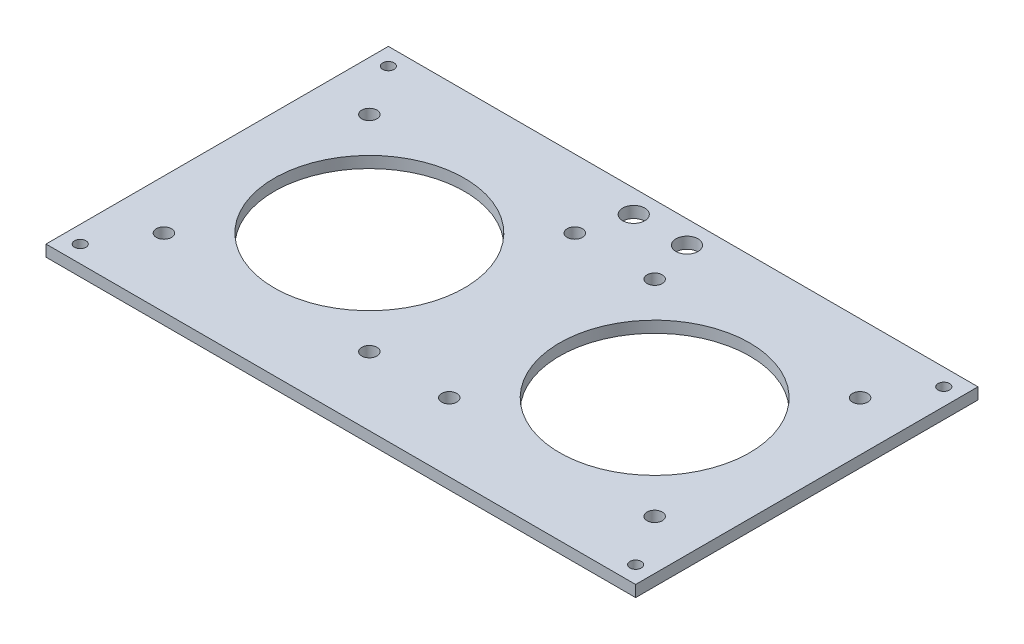
from build123d import *

# Parameters (mm, degrees)
ESQUISSE1_W        = 155
ESQUISSE1_H        = 90
ESQUISSE1_R        = 25
ESQUISSE1_R_2      = 2
ESQUISSE1_R_3      = 1.5
ESQUISSE1_R_4      = 2.9
BOSS_EXTRU_1_DEPTH = 3


with BuildPart() as part:
    # Esquisse1 → Boss.-Extru.1 (new body)
    with BuildSketch(Plane(origin=(0, 0, 0), x_dir=(1, 0, 0), z_dir=(0, 1, 0))):
        Rectangle(ESQUISSE1_W, ESQUISSE1_H)
        with Locations(Location((-37.5, 0, 0), (0, 0, 270))):
            Circle(ESQUISSE1_R, mode=Mode.SUBTRACT)
        with Locations(Location((-64.5, 27, 0), (0, 0, 270))):
            Circle(ESQUISSE1_R_2, mode=Mode.SUBTRACT)
        with Locations(Location((-10.5, 27, 0), (0, 0, 90))):
            Circle(ESQUISSE1_R_2, mode=Mode.SUBTRACT)
        with Locations(Location((-10.5, -27, 0), (0, 0, 270))):
            Circle(ESQUISSE1_R_2, mode=Mode.SUBTRACT)
        with Locations(Location((-64.5, -27, 0), (0, 0, 90))):
            Circle(ESQUISSE1_R_2, mode=Mode.SUBTRACT)
        with Locations(Location((10.5, -27, 0), (0, 0, 90))):
            Circle(ESQUISSE1_R_2, mode=Mode.SUBTRACT)
        with Locations(Location((64.5, -27, 0), (0, 0, 270))):
            Circle(ESQUISSE1_R_2, mode=Mode.SUBTRACT)
        with Locations(Location((64.5, 27, 0), (0, 0, 90))):
            Circle(ESQUISSE1_R_2, mode=Mode.SUBTRACT)
        with Locations(Location((10.5, 27, 0), (0, 0, 270))):
            Circle(ESQUISSE1_R_2, mode=Mode.SUBTRACT)
        with Locations(Location((37.5, 0, 0), (0, 0, 90))):
            Circle(ESQUISSE1_R, mode=Mode.SUBTRACT)
        with Locations(Location((-73, 40.5, 0), (0, 0, 270))):
            Circle(ESQUISSE1_R_3, mode=Mode.SUBTRACT)
        with Locations(Location((73, 40.5, 0), (0, 0, 90))):
            Circle(ESQUISSE1_R_3, mode=Mode.SUBTRACT)
        with Locations(Location((73, -40.5, 0), (0, 0, 270))):
            Circle(ESQUISSE1_R_3, mode=Mode.SUBTRACT)
        with Locations(Location((-73, -40.5, 0), (0, 0, 90))):
            Circle(ESQUISSE1_R_3, mode=Mode.SUBTRACT)
        with Locations(Location((-7, 39, 0), (0, 0, 270))):
            Circle(ESQUISSE1_R_4, mode=Mode.SUBTRACT)
        with Locations(Location((7, 39, 0), (0, 0, 90))):
            Circle(ESQUISSE1_R_4, mode=Mode.SUBTRACT)
    extrude(amount=BOSS_EXTRU_1_DEPTH)


solid = part.part
